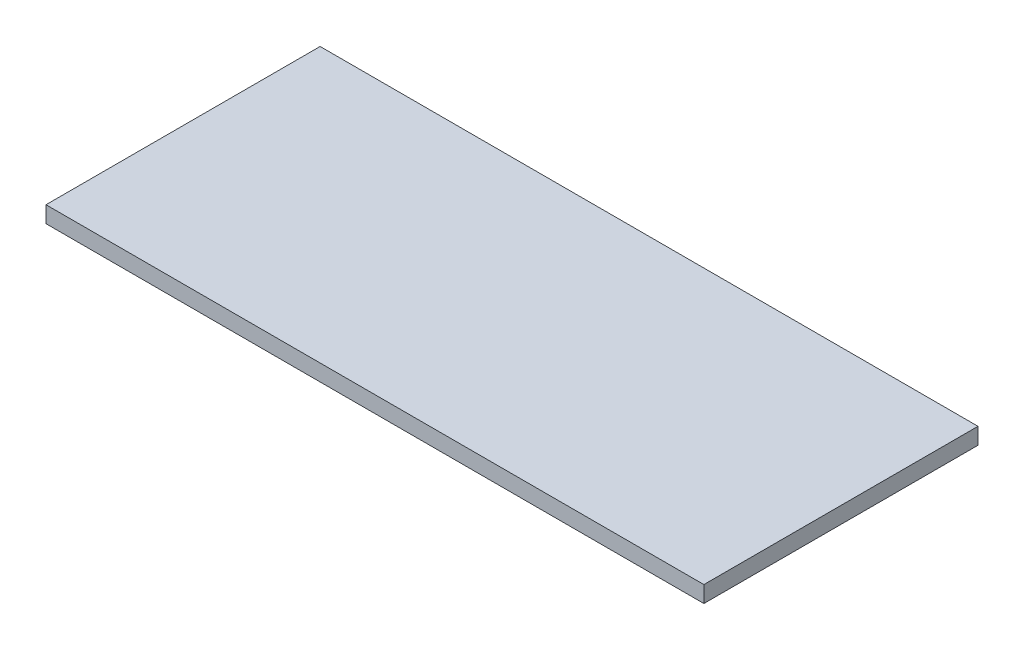
from build123d import *

# Parameters (mm, degrees)
SKETCH1_W           = 120
SKETCH1_H           = 50
BOSS_EXTRUDE1_DEPTH = 3


with BuildPart() as part:
    # Sketch1 → Boss-Extrude1 (new body)
    with BuildSketch(Plane(origin=(0, 0, 0), x_dir=(1, 0, 0), z_dir=(0, 1, 0))):
        with Locations((60, 25)):
            Rectangle(SKETCH1_W, SKETCH1_H)
    extrude(amount=BOSS_EXTRUDE1_DEPTH)


solid = part.part
